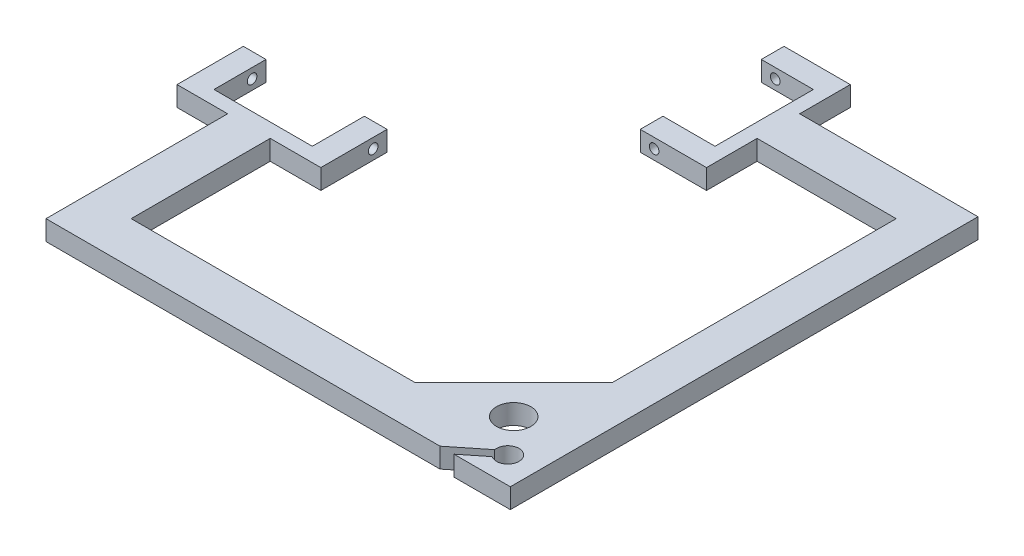
from build123d import *

# Parameters (mm, degrees)
SKETCH1_R           = 6.05
BOSS_EXTRUDE1_DEPTH = 7
SKETCH2_R           = 1.7
CUT_EXTRUDE1_DEPTH  = 60
SKETCH3_R           = 1.7
CUT_EXTRUDE2_DEPTH  = 60


with BuildPart() as part:
    # Sketch1 → Boss-Extrude1 (new body)
    with BuildSketch(Plane(origin=(0, 0, 0), x_dir=(1, 0, 0), z_dir=(0, 1, 0))):
        with BuildLine():
            Line((-87.25, -27.005178012), (-87.25, -45.345178012))
            Line((-87.25, -45.345178012), (-52.6, -45.345178012))
            Line((-52.6, -45.345178012), (-52.6, -27.005178012))
            Line((-52.6, -27.005178012), (-44.6, -27.005178012))
            Line((-44.6, -27.005178012), (-44.6, -50.345178012))
            Line((-44.6, -50.345178012), (-62.425, -50.345178012))
            Line((-62.425, -50.345178012), (-62.425, -99.345178012))
            Line((-62.425, -99.345178012), (37.575, -99.345178012))
            Line((37.575, -99.345178012), (72.34, -64.580178012))
            Line((72.34, -64.580178012), (72.34, 35.419821988))
            Line((72.34, 35.419821988), (23.34, 35.419821988))
            Line((23.34, 35.419821988), (23.34, 17.594821988))
            Line((23.34, 17.594821988), (0, 17.594821988))
            Line((0, 17.594821988), (0, 25.594821988))
            Line((0, 25.594821988), (18.34, 25.594821988))
            Line((18.34, 25.594821988), (18.34, 60.244821988))
            Line((18.34, 60.244821988), (0, 60.244821988))
            Line((0, 60.244821988), (0, 68.244821988))
            Line((0, 68.244821988), (23.34, 68.244821988))
            Line((23.34, 68.244821988), (23.34, 50.419821988))
            Line((23.34, 50.419821988), (86.165, 50.419821988))
            Line((86.165, 50.419821988), (86.165, -65.755178012))
            Line((86.165, -65.755178012), (86.165, -114.345178012))
            Line((86.165, -114.345178012), (66.299963518, -114.345178012))
            Line((66.299963518, -114.345178012), (73.771063238, -108.363510987))
            ThreePointArc((73.771063238, -108.363510987), (79.319481987, -102.911578198), (72.090531111, -105.783997211))
            Line((72.090531111, -105.783997211), (61.397619718, -114.345178012))
            Line((61.397619718, -114.345178012), (37.575, -114.345178012))
            Line((37.575, -114.345178012), (-77.425, -114.345178012))
            Line((-77.425, -114.345178012), (-77.425, -50.345178012))
            Line((-77.425, -50.345178012), (-95.25, -50.345178012))
            Line((-95.25, -50.345178012), (-95.25, -27.005178012))
            Line((-95.25, -27.005178012), (-87.25, -27.005178012))
        make_face()
        with Locations(Location((65.34, -92.345178012, 0), (0, 0, 270))):
            Circle(SKETCH1_R, mode=Mode.SUBTRACT)
    extrude(amount=BOSS_EXTRUDE1_DEPTH)

    # Sketch2 → Cut-Extrude1 (cut)
    with BuildSketch(Plane.XY.offset(-17.594821988)):
        with Locations((4.9, 3.5)):
            Circle(SKETCH2_R)
    extrude(amount=-CUT_EXTRUDE1_DEPTH, mode=Mode.SUBTRACT)

    # Sketch3 → Cut-Extrude2 (cut)
    with BuildSketch(Plane(origin=(-44.6, 0, 0), x_dir=(0, 0, -1), z_dir=(1, 0, 0))):
        with Locations((-31.905178012, 3.5)):
            Circle(SKETCH3_R)
    extrude(amount=-CUT_EXTRUDE2_DEPTH, mode=Mode.SUBTRACT)


solid = part.part
